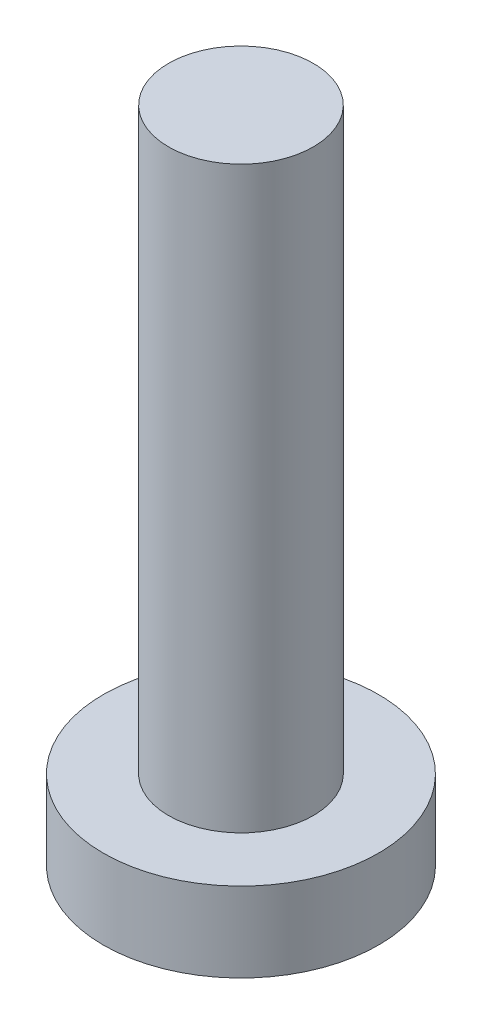
from build123d import *

# Parameters (mm, degrees)
SKETCH_1_R      = 2.85
EXTRUDE_1_DEPTH = 1.65
SKETCH_2_R      = 1.5
EXTRUDE_2_DEPTH = 12


with BuildPart() as part:
    # 草图1 → 凸台-拉伸1 (new body)
    with BuildSketch(Plane(origin=(0, 0, 0), x_dir=(1, 0, 0), z_dir=(0, 1, 0))):
        with Locations(Location((0, 0, 0), (0, 0, 270))):
            Circle(SKETCH_1_R)
    extrude(amount=EXTRUDE_1_DEPTH)

    # 草图2 → 凸台-拉伸2 (add)
    with BuildSketch(Plane(origin=(0, 1.65, 0), x_dir=(1, 0, 0), z_dir=(0, 1, 0))):
        with Locations(Location((0, 0, 0), (0, 0, 270))):
            Circle(SKETCH_2_R)
    extrude(amount=EXTRUDE_2_DEPTH)


solid = part.part
